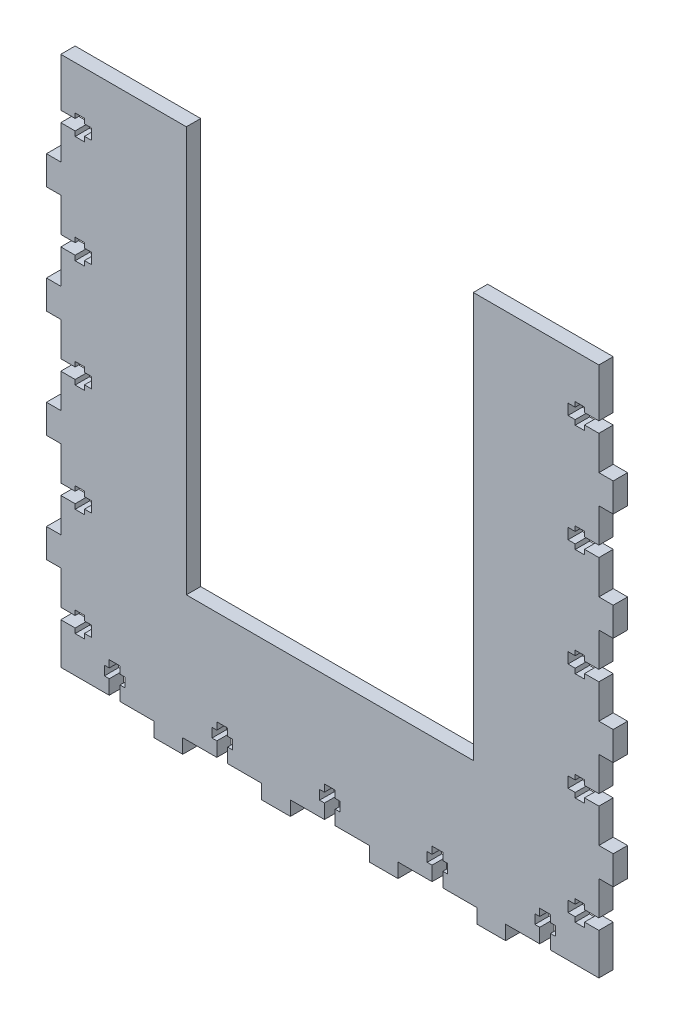
from build123d import *

# Parameters (mm, degrees)
EXTRUDE_1_DEPTH     = 4
SKETCH_4_W          = 80
SKETCH_4_H          = 113
CUT_EXTRUDE_1_DEPTH = 4


with BuildPart() as part:
    # 草图1 → 凸台-拉伸1 (new body)
    with BuildSketch(Plane.XY):
        Polygon((145, 56.5), (149, 56.5), (149, 55.15), (151.6, 55.15), (151.6, 56.5), (153.6, 56.5), (153.6, 59.5), (151.6, 59.5), (151.6, 60.85), (149, 60.85), (149, 59.5), (145, 59.5), (145, 69), (141, 69), (141, 77), (145, 77), (145, 86.5), (149, 86.5), (149, 85.15), (151.6, 85.15), (151.6, 86.5), (153.6, 86.5), (153.6, 89.5), (151.6, 89.5), (151.6, 90.85), (149, 90.85), (149, 89.5), (145, 89.5), (145, 99), (141, 99), (141, 107), (145, 107), (145, 116.5), (149, 116.5), (149, 115.15), (151.6, 115.15), (151.6, 116.5), (153.6, 116.5), (153.6, 119.5), (151.6, 119.5), (151.6, 120.85), (149, 120.85), (149, 119.5), (145, 119.5), (145, 133), (295, 133), (295, 119.5), (291, 119.5), (291, 120.85), (288.4, 120.85), (288.4, 119.5), (286.4, 119.5), (286.4, 116.5), (288.4, 116.5), (288.4, 115.15), (291, 115.15), (291, 116.5), (295, 116.5), (295, 107), (299, 107), (299, 99), (295, 99), (295, 89.5), (291, 89.5), (291, 90.85), (288.4, 90.85), (288.4, 89.5), (286.4, 89.5), (286.4, 86.5), (288.4, 86.5), (288.4, 85.15), (291, 85.15), (291, 86.5), (295, 86.5), (295, 77), (299, 77), (299, 69), (295, 69), (295, 59.5), (291, 59.5), (291, 60.85), (288.4, 60.85), (288.4, 59.5), (286.4, 59.5), (286.4, 56.5), (288.4, 56.5), (288.4, 55.15), (291, 55.15), (291, 56.5), (295, 56.5), (295, 47), (299, 47), (299, 39), (295, 39), (295, 29.5), (291, 29.5), (291, 30.85), (288.4, 30.85), (288.4, 29.5), (286.4, 29.5), (286.4, 26.5), (288.4, 26.5), (288.4, 25.15), (291, 25.15), (291, 26.5), (295, 26.5), (295, 17), (299, 17), (299, 9), (295, 9), (295, -0.5), (291, -0.5), (291, 0.85), (288.4, 0.85), (288.4, -0.5), (286.4, -0.5), (286.4, -3.5), (288.4, -3.5), (288.4, -4.85), (291, -4.85), (291, -3.5), (295, -3.5), (295, -15), (281.5, -15), (281.5, -11), (282.85, -11), (282.85, -8.4), (281.5, -8.4), (281.5, -6.4), (278.5, -6.4), (278.5, -8.4), (277.15, -8.4), (277.15, -11), (278.5, -11), (278.5, -15), (269, -15), (269, -19), (261, -19), (261, -15), (251.5, -15), (251.5, -11), (252.85, -11), (252.85, -8.4), (251.5, -8.4), (251.5, -6.4), (248.5, -6.4), (248.5, -8.4), (247.15, -8.4), (247.15, -11), (248.5, -11), (248.5, -15), (239, -15), (239, -19), (231, -19), (231, -15), (221.5, -15), (221.5, -11), (222.85, -11), (222.85, -8.4), (221.5, -8.4), (221.5, -6.4), (218.5, -6.4), (218.5, -8.4), (217.15, -8.4), (217.15, -11), (218.5, -11), (218.5, -15), (209, -15), (209, -19), (201, -19), (201, -15), (191.5, -15), (191.5, -11), (192.85, -11), (192.85, -8.4), (191.5, -8.4), (191.5, -6.4), (188.5, -6.4), (188.5, -8.4), (187.15, -8.4), (187.15, -11), (188.5, -11), (188.5, -15), (179, -15), (179, -19), (171, -19), (171, -15), (161.5, -15), (161.5, -11), (162.85, -11), (162.85, -8.4), (161.5, -8.4), (161.5, -6.4), (158.5, -6.4), (158.5, -8.4), (157.15, -8.4), (157.15, -11), (158.5, -11), (158.5, -15), (145, -15), (145, -3.5), (149, -3.5), (149, -4.85), (151.6, -4.85), (151.6, -3.5), (153.6, -3.5), (153.6, -0.5), (151.6, -0.5), (151.6, 0.85), (149, 0.85), (149, -0.5), (145, -0.5), (145, 9), (141, 9), (141, 17), (145, 17), (145, 26.5), (149, 26.5), (149, 25.15), (151.6, 25.15), (151.6, 26.5), (153.6, 26.5), (153.6, 29.5), (151.6, 29.5), (151.6, 30.85), (149, 30.85), (149, 29.5), (145, 29.5), (145, 39), (141, 39), (141, 47), (145, 47), align=None)
    extrude(amount=EXTRUDE_1_DEPTH)

    # 草图4 → 切除-拉伸1 (cut)
    with BuildSketch(Plane(origin=(0, 0, 0), x_dir=(-1, 0, 0), z_dir=(0, 0, -1))):
        with Locations((-220, 76.5)):
            Rectangle(SKETCH_4_W, SKETCH_4_H)
    extrude(amount=-CUT_EXTRUDE_1_DEPTH, mode=Mode.SUBTRACT)


solid = part.part
